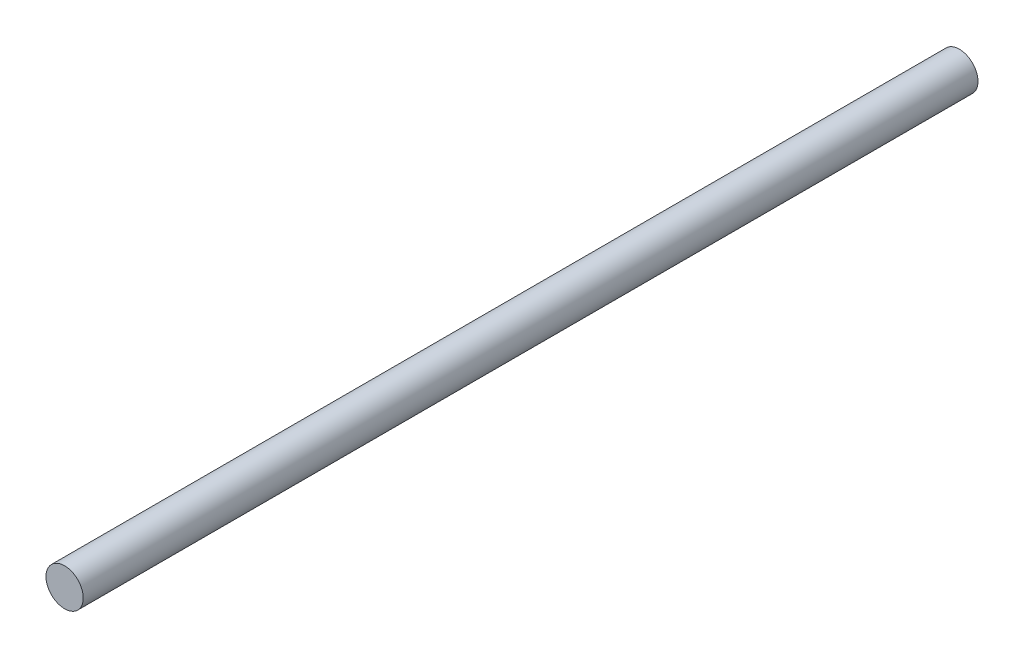
from build123d import *

# Parameters (mm, degrees)
TIE_STUD_START = -38
SKETCH_1_R     = 2
TIE_STUD_DEPTH = 96


with BuildPart() as part:
    # Эскиз1 → Tie_stud (new body)
    with BuildSketch(Plane.XY.offset(TIE_STUD_START)):
        Circle(SKETCH_1_R)
    extrude(amount=TIE_STUD_DEPTH)


solid = part.part
